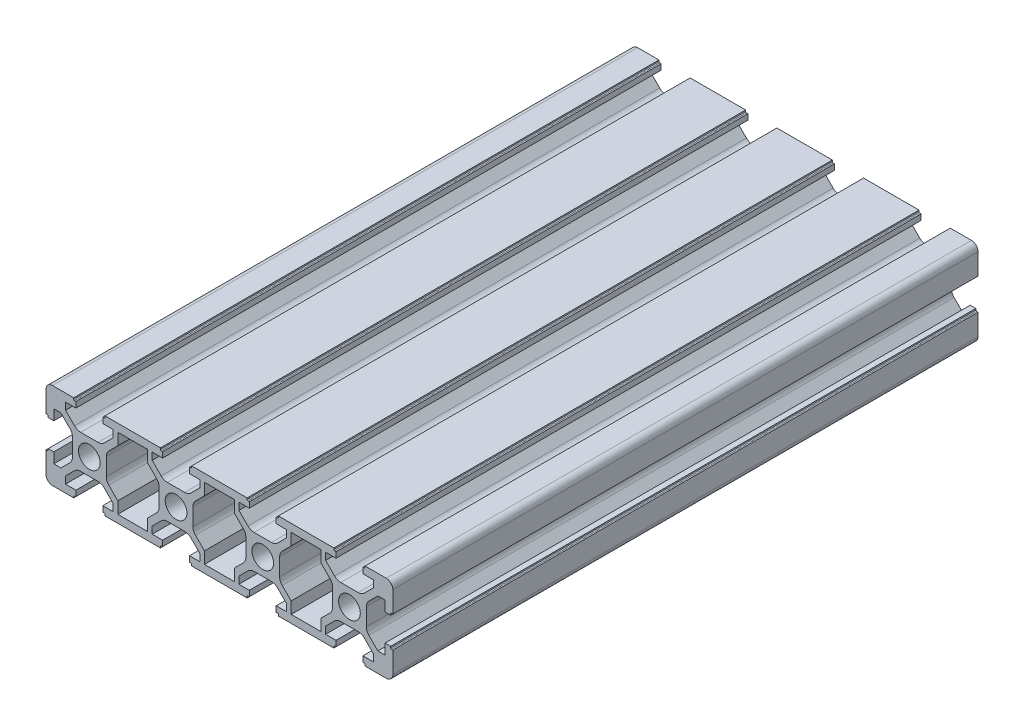
from build123d import *

# Parameters (mm, degrees)
SKETCH2_W               = 80
SKETCH2_H               = 20
BOSS_EXTRUDE1_DEPTH     = 67.5
CUT_EXTRUDE1_DEPTH      = 142.155942135
CUT_EXTRUDE1_DEPTH_BACK = 142.155942135
SKETCH3_R               = 2.5
FILLET1_R               = 1.5


with BuildPart() as part:
    # Sketch2 → Boss-Extrude1 (new, symmetric)
    with BuildSketch(Plane.XY):
        Rectangle(SKETCH2_W, SKETCH2_H)
    extrude(amount=BOSS_EXTRUDE1_DEPTH, both=True)

    # Sketch3 → Cut-Extrude1 (cut, two sides: drawn at the far end of the back side and taken through both)
    with BuildSketch(Plane.XY.offset(67.5).offset(-CUT_EXTRUDE1_DEPTH_BACK)):
        with Locations((-10, 0)):
            Circle(SKETCH3_R)
        with Locations(Location((10, 0, 0), (0, 0, 180))):
            Circle(SKETCH3_R)
        with Locations((-30, 0)):
            Circle(SKETCH3_R)
        with Locations((30, 0)):
            Circle(SKETCH3_R)
        with BuildLine():
            Line((-13.6, 10), (-6.4, 10))
            Line((-6.4, 10), (-6.4, 9.7))
            ThreePointArc((-6.4, 9.7), (-6.458578644, 9.558578644), (-6.6, 9.5))
            Line((-6.6, 9.5), (-6.9, 9.5))
            Line((-6.9, 9.5), (-6.9, 8.2))
            Line((-6.9, 8.2), (-4.5, 8.2))
            Line((-4.5, 8.2), (-4.5, 6.560660172))
            Line((-4.5, 6.560660172), (-6.574873734, 4.485786438))
            ThreePointArc((-6.574873734, 4.485786438), (-7.223720432, 4.052240935), (-7.989087297, 3.9))
            Line((-7.989087297, 3.9), (-12.010912703, 3.9))
            ThreePointArc((-12.010912703, 3.9), (-12.776279568, 4.052240935), (-13.425126266, 4.485786438))
            Line((-13.425126266, 4.485786438), (-15.5, 6.560660172))
            Line((-15.5, 6.560660172), (-15.5, 8.2))
            Line((-15.5, 8.2), (-13.1, 8.2))
            Line((-13.1, 8.2), (-13.1, 9.5))
            Line((-13.1, 9.5), (-13.4, 9.5))
            ThreePointArc((-13.4, 9.5), (-13.541421356, 9.558578644), (-13.6, 9.7))
            Line((-13.6, 9.7), (-13.6, 10))
        make_face()
        with BuildLine():
            Line((-13.6, -10), (-13.6, -9.7))
            ThreePointArc((-13.6, -9.7), (-13.541421356, -9.558578644), (-13.4, -9.5))
            Line((-13.4, -9.5), (-13.1, -9.5))
            Line((-13.1, -9.5), (-13.1, -8.2))
            Line((-13.1, -8.2), (-15.5, -8.2))
            Line((-15.5, -8.2), (-15.5, -6.560660172))
            Line((-15.5, -6.560660172), (-13.425126266, -4.485786438))
            ThreePointArc((-13.425126266, -4.485786438), (-12.776279568, -4.052240935), (-12.010912703, -3.9))
            Line((-12.010912703, -3.9), (-7.989087297, -3.9))
            ThreePointArc((-7.989087297, -3.9), (-7.223720432, -4.052240935), (-6.574873734, -4.485786438))
            Line((-6.574873734, -4.485786438), (-4.5, -6.560660172))
            Line((-4.5, -6.560660172), (-4.5, -8.2))
            Line((-4.5, -8.2), (-6.9, -8.2))
            Line((-6.9, -8.2), (-6.9, -9.5))
            Line((-6.9, -9.5), (-6.6, -9.5))
            ThreePointArc((-6.6, -9.5), (-6.458578644, -9.558578644), (-6.4, -9.7))
            Line((-6.4, -9.7), (-6.4, -10))
            Line((-6.4, -10), (-13.6, -10))
        make_face()
        with BuildLine():
            Line((13.6, -10), (6.4, -10))
            Line((6.4, -10), (6.4, -9.7))
            ThreePointArc((6.4, -9.7), (6.458578644, -9.558578644), (6.6, -9.5))
            Line((6.6, -9.5), (6.9, -9.5))
            Line((6.9, -9.5), (6.9, -8.2))
            Line((6.9, -8.2), (4.5, -8.2))
            Line((4.5, -8.2), (4.5, -6.560660172))
            Line((4.5, -6.560660172), (6.574873734, -4.485786438))
            ThreePointArc((6.574873734, -4.485786438), (7.223720432, -4.052240935), (7.989087297, -3.9))
            Line((7.989087297, -3.9), (12.010912703, -3.9))
            ThreePointArc((12.010912703, -3.9), (12.776279568, -4.052240935), (13.425126266, -4.485786438))
            Line((13.425126266, -4.485786438), (15.5, -6.560660172))
            Line((15.5, -6.560660172), (15.5, -8.2))
            Line((15.5, -8.2), (13.1, -8.2))
            Line((13.1, -8.2), (13.1, -9.5))
            Line((13.1, -9.5), (13.4, -9.5))
            ThreePointArc((13.4, -9.5), (13.541421356, -9.558578644), (13.6, -9.7))
            Line((13.6, -9.7), (13.6, -10))
        make_face()
        with BuildLine():
            Line((13.6, 10), (13.6, 9.7))
            ThreePointArc((13.6, 9.7), (13.541421356, 9.558578644), (13.4, 9.5))
            Line((13.4, 9.5), (13.1, 9.5))
            Line((13.1, 9.5), (13.1, 8.2))
            Line((13.1, 8.2), (15.5, 8.2))
            Line((15.5, 8.2), (15.5, 6.560660172))
            Line((15.5, 6.560660172), (13.425126266, 4.485786438))
            ThreePointArc((13.425126266, 4.485786438), (12.776279568, 4.052240935), (12.010912703, 3.9))
            Line((12.010912703, 3.9), (7.989087297, 3.9))
            ThreePointArc((7.989087297, 3.9), (7.223720432, 4.052240935), (6.574873734, 4.485786438))
            Line((6.574873734, 4.485786438), (4.5, 6.560660172))
            Line((4.5, 6.560660172), (4.5, 8.2))
            Line((4.5, 8.2), (6.9, 8.2))
            Line((6.9, 8.2), (6.9, 9.5))
            Line((6.9, 9.5), (6.6, 9.5))
            ThreePointArc((6.6, 9.5), (6.458578644, 9.558578644), (6.4, 9.7))
            Line((6.4, 9.7), (6.4, 10))
            Line((6.4, 10), (13.6, 10))
        make_face()
        with BuildLine():
            Line((-36.560660172, -5.5), (-38.2, -5.5))
            Line((-38.2, -5.5), (-38.2, -3.1))
            Line((-38.2, -3.1), (-39.5, -3.1))
            Line((-39.5, -3.1), (-39.5, -3.4))
            ThreePointArc((-39.5, -3.4), (-39.558578644, -3.541421356), (-39.7, -3.6))
            Line((-39.7, -3.6), (-40, -3.6))
            Line((-40, -3.6), (-40, 3.6))
            Line((-40, 3.6), (-39.7, 3.6))
            ThreePointArc((-39.7, 3.6), (-39.558578644, 3.541421356), (-39.5, 3.4))
            Line((-39.5, 3.4), (-39.5, 3.1))
            Line((-39.5, 3.1), (-38.2, 3.1))
            Line((-38.2, 3.1), (-38.2, 5.5))
            Line((-38.2, 5.5), (-36.560660172, 5.5))
            Line((-36.560660172, 5.5), (-34.485786438, 3.425126266))
            ThreePointArc((-34.485786438, 3.425126266), (-34.052240935, 2.776279568), (-33.9, 2.010912703))
            Line((-33.9, 2.010912703), (-33.9, -2.010912703))
            ThreePointArc((-33.9, -2.010912703), (-34.052240935, -2.776279568), (-34.485786438, -3.425126266))
            Line((-34.485786438, -3.425126266), (-36.560660172, -5.5))
        make_face()
        with BuildLine():
            Line((34.485786438, -3.425126266), (36.560660172, -5.5))
            Line((36.560660172, -5.5), (38.2, -5.5))
            Line((38.2, -5.5), (38.2, -3.1))
            Line((38.2, -3.1), (39.5, -3.1))
            Line((39.5, -3.1), (39.5, -3.4))
            ThreePointArc((39.5, -3.4), (39.558578644, -3.541421356), (39.7, -3.6))
            Line((39.7, -3.6), (40, -3.6))
            Line((40, -3.6), (40, 3.6))
            Line((40, 3.6), (39.7, 3.6))
            ThreePointArc((39.7, 3.6), (39.558578644, 3.541421356), (39.5, 3.4))
            Line((39.5, 3.4), (39.5, 3.1))
            Line((39.5, 3.1), (38.2, 3.1))
            Line((38.2, 3.1), (38.2, 5.5))
            Line((38.2, 5.5), (36.560660172, 5.5))
            Line((36.560660172, 5.5), (34.485786438, 3.425126266))
            ThreePointArc((34.485786438, 3.425126266), (34.052240935, 2.776279568), (33.9, 2.010912703))
            Line((33.9, 2.010912703), (33.9, -2.010912703))
            ThreePointArc((33.9, -2.010912703), (34.052240935, -2.776279568), (34.485786438, -3.425126266))
        make_face()
        with BuildLine():
            Line((-3.439339828, 8.2), (-3.439339828, 5.5))
            Line((-3.439339828, 5.5), (-5.514213562, 3.425126266))
            ThreePointArc((-5.514213562, 3.425126266), (-5.947759065, 2.776279568), (-6.1, 2.010912703))
            Line((-6.1, 2.010912703), (-6.1, -2.010912703))
            ThreePointArc((-6.1, -2.010912703), (-5.947759065, -2.776279568), (-5.514213562, -3.425126266))
            Line((-5.514213562, -3.425126266), (-3.439339828, -5.5))
            Line((-3.439339828, -5.5), (-3.439339828, -8.2))
            Line((-3.439339828, -8.2), (3.439339828, -8.2))
            Line((3.439339828, -8.2), (3.439339828, -5.5))
            Line((3.439339828, -5.5), (5.514213562, -3.425126266))
            ThreePointArc((5.514213562, -3.425126266), (5.947759065, -2.776279568), (6.1, -2.010912703))
            Line((6.1, -2.010912703), (6.1, 2.010912703))
            ThreePointArc((6.1, 2.010912703), (5.947759065, 2.776279568), (5.514213562, 3.425126266))
            Line((5.514213562, 3.425126266), (3.439339828, 5.5))
            Line((3.439339828, 5.5), (3.439339828, 8.2))
            Line((3.439339828, 8.2), (-3.439339828, 8.2))
        make_face()
        with BuildLine():
            Line((-26.4, 10), (-26.4, 9.7))
            ThreePointArc((-26.4, 9.7), (-26.458578644, 9.558578644), (-26.6, 9.5))
            Line((-26.6, 9.5), (-26.9, 9.5))
            Line((-26.9, 9.5), (-26.9, 8.2))
            Line((-26.9, 8.2), (-24.5, 8.2))
            Line((-24.5, 8.2), (-24.5, 6.560660172))
            Line((-24.5, 6.560660172), (-26.574873734, 4.485786438))
            ThreePointArc((-26.574873734, 4.485786438), (-27.223720432, 4.052240935), (-27.989087297, 3.9))
            Line((-27.989087297, 3.9), (-32.010912703, 3.9))
            ThreePointArc((-32.010912703, 3.9), (-32.776279568, 4.052240935), (-33.425126266, 4.485786438))
            Line((-33.425126266, 4.485786438), (-35.5, 6.560660172))
            Line((-35.5, 6.560660172), (-35.5, 8.2))
            Line((-35.5, 8.2), (-33.1, 8.2))
            Line((-33.1, 8.2), (-33.1, 9.5))
            Line((-33.1, 9.5), (-33.4, 9.5))
            ThreePointArc((-33.4, 9.5), (-33.541421356, 9.558578644), (-33.6, 9.7))
            Line((-33.6, 9.7), (-33.6, 10))
            Line((-33.6, 10), (-26.4, 10))
        make_face()
        with BuildLine():
            Line((-26.4, -10), (-33.6, -10))
            Line((-33.6, -10), (-33.6, -9.7))
            ThreePointArc((-33.6, -9.7), (-33.541421356, -9.558578644), (-33.4, -9.5))
            Line((-33.4, -9.5), (-33.1, -9.5))
            Line((-33.1, -9.5), (-33.1, -8.2))
            Line((-33.1, -8.2), (-35.5, -8.2))
            Line((-35.5, -8.2), (-35.5, -6.560660172))
            Line((-35.5, -6.560660172), (-33.425126266, -4.485786438))
            ThreePointArc((-33.425126266, -4.485786438), (-32.776279568, -4.052240935), (-32.010912703, -3.9))
            Line((-32.010912703, -3.9), (-27.989087297, -3.9))
            ThreePointArc((-27.989087297, -3.9), (-27.223720432, -4.052240935), (-26.574873734, -4.485786438))
            Line((-26.574873734, -4.485786438), (-24.5, -6.560660172))
            Line((-24.5, -6.560660172), (-24.5, -8.2))
            Line((-24.5, -8.2), (-26.9, -8.2))
            Line((-26.9, -8.2), (-26.9, -9.5))
            Line((-26.9, -9.5), (-26.6, -9.5))
            ThreePointArc((-26.6, -9.5), (-26.458578644, -9.558578644), (-26.4, -9.7))
            Line((-26.4, -9.7), (-26.4, -10))
        make_face()
        with BuildLine():
            Line((26.4, 10), (33.6, 10))
            Line((33.6, 10), (33.6, 9.7))
            ThreePointArc((33.6, 9.7), (33.541421356, 9.558578644), (33.4, 9.5))
            Line((33.4, 9.5), (33.1, 9.5))
            Line((33.1, 9.5), (33.1, 8.2))
            Line((33.1, 8.2), (35.5, 8.2))
            Line((35.5, 8.2), (35.5, 6.560660172))
            Line((35.5, 6.560660172), (33.425126266, 4.485786438))
            ThreePointArc((33.425126266, 4.485786438), (32.776279568, 4.052240935), (32.010912703, 3.9))
            Line((32.010912703, 3.9), (27.989087297, 3.9))
            ThreePointArc((27.989087297, 3.9), (27.223720432, 4.052240935), (26.574873734, 4.485786438))
            Line((26.574873734, 4.485786438), (24.5, 6.560660172))
            Line((24.5, 6.560660172), (24.5, 8.2))
            Line((24.5, 8.2), (26.9, 8.2))
            Line((26.9, 8.2), (26.9, 9.5))
            Line((26.9, 9.5), (26.6, 9.5))
            ThreePointArc((26.6, 9.5), (26.458578644, 9.558578644), (26.4, 9.7))
            Line((26.4, 9.7), (26.4, 10))
        make_face()
        with BuildLine():
            Line((26.4, -10), (26.4, -9.7))
            ThreePointArc((26.4, -9.7), (26.458578644, -9.558578644), (26.6, -9.5))
            Line((26.6, -9.5), (26.9, -9.5))
            Line((26.9, -9.5), (26.9, -8.2))
            Line((26.9, -8.2), (24.5, -8.2))
            Line((24.5, -8.2), (24.5, -6.560660172))
            Line((24.5, -6.560660172), (26.574873734, -4.485786438))
            ThreePointArc((26.574873734, -4.485786438), (27.223720432, -4.052240935), (27.989087297, -3.9))
            Line((27.989087297, -3.9), (32.010912703, -3.9))
            ThreePointArc((32.010912703, -3.9), (32.776279568, -4.052240935), (33.425126266, -4.485786438))
            Line((33.425126266, -4.485786438), (35.5, -6.560660172))
            Line((35.5, -6.560660172), (35.5, -8.2))
            Line((35.5, -8.2), (33.1, -8.2))
            Line((33.1, -8.2), (33.1, -9.5))
            Line((33.1, -9.5), (33.4, -9.5))
            ThreePointArc((33.4, -9.5), (33.541421356, -9.558578644), (33.6, -9.7))
            Line((33.6, -9.7), (33.6, -10))
            Line((33.6, -10), (26.4, -10))
        make_face()
        with BuildLine():
            Line((-16.560660172, -5.5), (-14.485786438, -3.425126266))
            ThreePointArc((-14.485786438, -3.425126266), (-14.052240935, -2.776279568), (-13.9, -2.010912703))
            Line((-13.9, -2.010912703), (-13.9, 2.010912703))
            ThreePointArc((-13.9, 2.010912703), (-14.052240935, 2.776279568), (-14.485786438, 3.425126266))
            Line((-14.485786438, 3.425126266), (-16.560660172, 5.5))
            Line((-16.560660172, 5.5), (-16.560660172, 8.2))
            Line((-16.560660172, 8.2), (-23.439339828, 8.2))
            Line((-23.439339828, 8.2), (-23.439339828, 5.5))
            Line((-23.439339828, 5.5), (-25.514213562, 3.425126266))
            ThreePointArc((-25.514213562, 3.425126266), (-25.947759065, 2.776279568), (-26.1, 2.010912703))
            Line((-26.1, 2.010912703), (-26.1, -2.010912703))
            ThreePointArc((-26.1, -2.010912703), (-25.947759065, -2.776279568), (-25.514213562, -3.425126266))
            Line((-25.514213562, -3.425126266), (-23.439339828, -5.5))
            Line((-23.439339828, -5.5), (-23.439339828, -8.2))
            Line((-23.439339828, -8.2), (-16.560660172, -8.2))
            Line((-16.560660172, -8.2), (-16.560660172, -5.5))
        make_face()
        with BuildLine():
            Line((23.439339828, -5.5), (25.514213562, -3.425126266))
            ThreePointArc((25.514213562, -3.425126266), (25.947759065, -2.776279568), (26.1, -2.010912703))
            Line((26.1, -2.010912703), (26.1, 2.010912703))
            ThreePointArc((26.1, 2.010912703), (25.947759065, 2.776279568), (25.514213562, 3.425126266))
            Line((25.514213562, 3.425126266), (23.439339828, 5.5))
            Line((23.439339828, 5.5), (23.439339828, 8.2))
            Line((23.439339828, 8.2), (16.560660172, 8.2))
            Line((16.560660172, 8.2), (16.560660172, 5.5))
            Line((16.560660172, 5.5), (14.485786438, 3.425126266))
            ThreePointArc((14.485786438, 3.425126266), (14.052240935, 2.776279568), (13.9, 2.010912703))
            Line((13.9, 2.010912703), (13.9, -2.010912703))
            ThreePointArc((13.9, -2.010912703), (14.052240935, -2.776279568), (14.485786438, -3.425126266))
            Line((14.485786438, -3.425126266), (16.560660172, -5.5))
            Line((16.560660172, -5.5), (16.560660172, -8.2))
            Line((16.560660172, -8.2), (23.439339828, -8.2))
            Line((23.439339828, -8.2), (23.439339828, -5.5))
        make_face()
    extrude(amount=CUT_EXTRUDE1_DEPTH + CUT_EXTRUDE1_DEPTH_BACK, mode=Mode.SUBTRACT)

    # Fillet1
    fillet1_edges = [part.edges().sort_by_distance(p)[0] for p in [
        (40, -10, 0),
        (-40, -10, 0),
        (-40, 10, 0),
        (40, 10, 0),
    ]]
    fillet(fillet1_edges, radius=FILLET1_R)


solid = part.part
